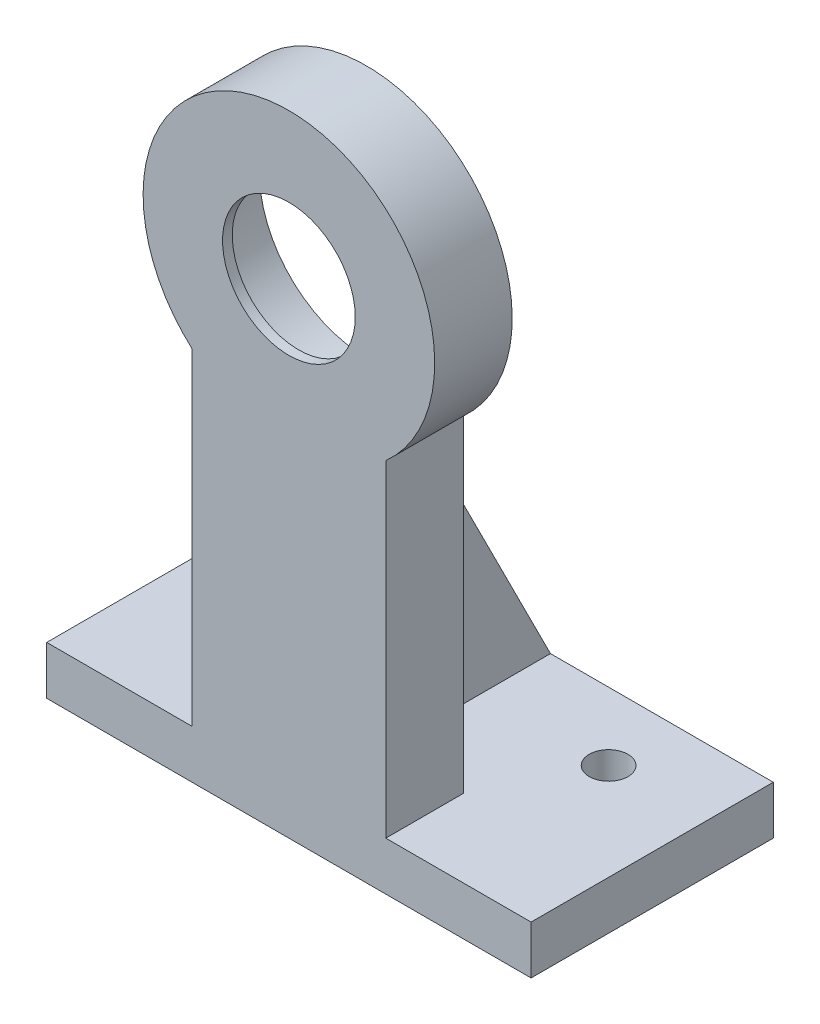
from build123d import *

# Parameters (mm, degrees)
SKETCH1_R                = 6.847967297
BOSS_EXTRUDE1_DEPTH      = 8
SKETCH1_3_R              = 11.05
SKETCH1_3_R_2            = 6.847967297
CUT_EXTRUDE1_DEPTH       = 7
SKETCH2_W                = 50
SKETCH2_H                = 25
SKETCH2_R                = 2
BOSS_EXTRUDE2_DEPTH      = 5
BOSS_EXTRUDE3_DEPTH      = 2
BOSS_EXTRUDE3_DEPTH_BACK = 2


with BuildPart() as part:
    # Sketch1 → Boss-Extrude1 (new body)
    with BuildSketch(Plane.XY):
        with BuildLine():
            ThreePointArc((10, -11.247333017), (0, 15.05), (-10, -11.247333017))
            Line((-10, -11.247333017), (-10, -50))
            Line((-10, -50), (10, -50))
            Line((10, -50), (10, -11.247333017))
        make_face()
        Circle(SKETCH1_R, mode=Mode.SUBTRACT)
    extrude(amount=BOSS_EXTRUDE1_DEPTH)

    # Sketch1<3> → Cut-Extrude1 (cut)
    with BuildSketch(Plane.XY):
        Circle(SKETCH1_3_R)
        Circle(SKETCH1_3_R_2, mode=Mode.SUBTRACT)
    extrude(amount=CUT_EXTRUDE1_DEPTH, mode=Mode.SUBTRACT)

    # Sketch2 → Boss-Extrude2 (add)
    with BuildSketch(Plane.XZ.offset(50)):
        with Locations((0, -4.5)):
            Rectangle(SKETCH2_W, SKETCH2_H)
        with Locations((-15, -10)):
            Circle(SKETCH2_R, mode=Mode.SUBTRACT)
        with Locations((15, -10)):
            Circle(SKETCH2_R, mode=Mode.SUBTRACT)
    extrude(amount=-BOSS_EXTRUDE2_DEPTH)

    # Sketch5 → Boss-Extrude3 (add, two sides: drawn at the far end of the back side and taken through both)
    with BuildSketch(Plane(origin=(0, 0, 0), x_dir=(0, 0, -1), z_dir=(1, 0, 0)).offset(-BOSS_EXTRUDE3_DEPTH_BACK)):
        Polygon((0, -11.247333017), (17, -45), (0, -45), align=None)
    extrude(amount=BOSS_EXTRUDE3_DEPTH + BOSS_EXTRUDE3_DEPTH_BACK)


solid = part.part
